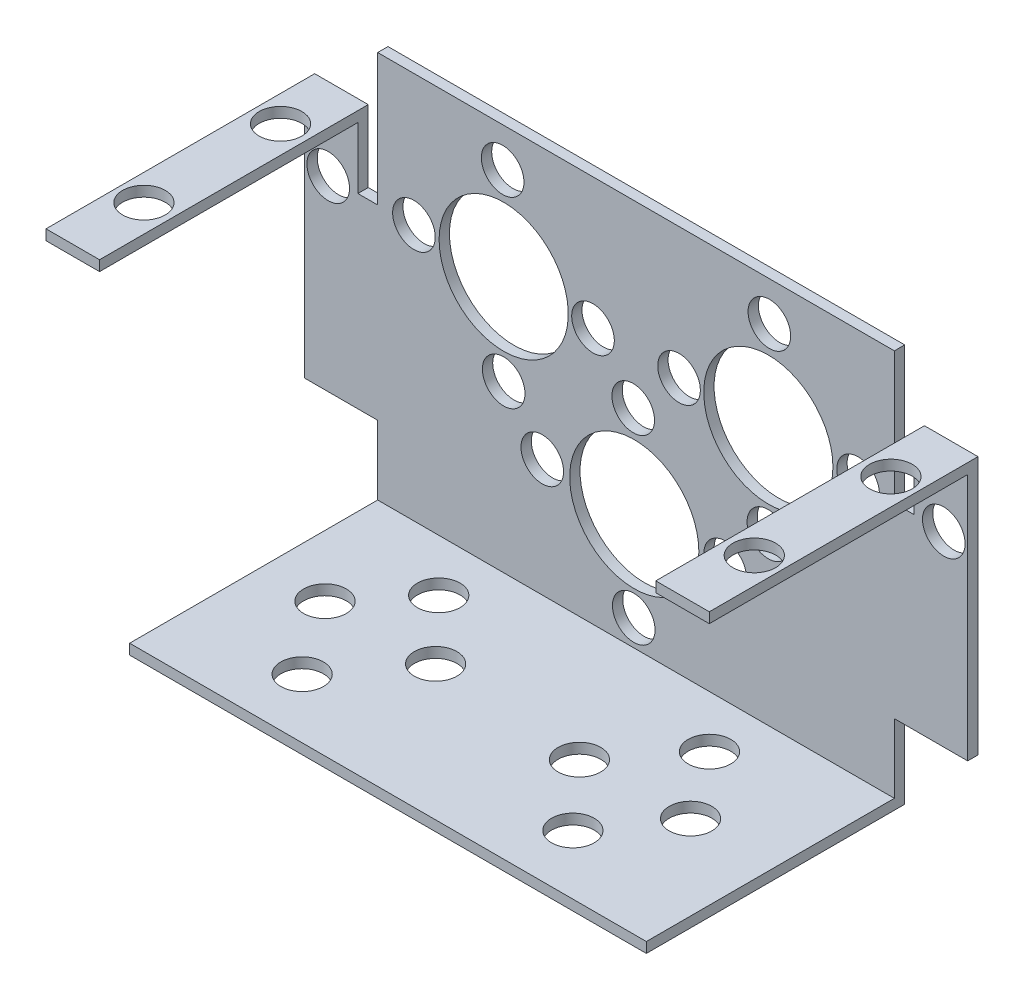
from build123d import *

# Parameters (mm, degrees)
SKETCH1_W           = 20
SKETCH1_H           = 20
BOSS_EXTRUDE1_DEPTH = 0.8
SKETCH2_W           = 20
SKETCH2_H           = 0.8
BOSS_EXTRUDE2_DEPTH = 30
SKETCH3_W           = 5.674043307
SKETCH3_H           = 20
BOSS_EXTRUDE3_DEPTH = 0.8
SKETCH4_W           = 1.528315809
SKETCH4_H           = 5.562769748
CUT_EXTRUDE1_DEPTH  = 0.8
SKETCH5_W           = 4.145727498
SKETCH5_H           = 0.8
BOSS_EXTRUDE4_DEPTH = 20
SKETCH6_R           = 5
SKETCH6_R_2         = 1.65
CUT_EXTRUDE2_DEPTH  = 20
SKETCH7_R           = 5
SKETCH7_R_2         = 1.65
CUT_EXTRUDE3_DEPTH  = 20
SKETCH8_R           = 1.65
CUT_EXTRUDE4_DEPTH  = 50


with BuildPart() as part:
    # Sketch1 → Boss-Extrude1 (new body)
    with BuildSketch(Plane(origin=(0, 0, 0), x_dir=(1, 0, 0), z_dir=(0, 1, 0))):
        with Locations((-32.618726592, -25.293632959)):
            Rectangle(SKETCH1_W, SKETCH1_H)
    extrude(amount=BOSS_EXTRUDE1_DEPTH)

    # Sketch2 → Boss-Extrude2 (add)
    with BuildSketch(Plane(origin=(0, 0.8, 0), x_dir=(1, 0, 0), z_dir=(0, 1, 0))):
        with Locations((-32.618726592, -15.693632959)):
            Rectangle(SKETCH2_W, SKETCH2_H)
    extrude(amount=BOSS_EXTRUDE2_DEPTH)

    # Sketch3 → Boss-Extrude3 (add)
    with BuildSketch(Plane.XY.offset(16.093632959)):
        with Locations((-19.781704938, 16.144118187)):
            Rectangle(SKETCH3_W, SKETCH3_H)
    extrude(amount=-BOSS_EXTRUDE3_DEPTH)

    # Sketch4 → Cut-Extrude1 (cut)
    with BuildSketch(Plane.XY.offset(16.093632959)):
        with Locations((-21.854568688, 23.362733313)):
            Rectangle(SKETCH4_W, SKETCH4_H)
    extrude(amount=-CUT_EXTRUDE1_DEPTH, mode=Mode.SUBTRACT)

    # Sketch5 → Boss-Extrude4 (add)
    with BuildSketch(Plane.XY.offset(16.093632959)):
        with Locations((-19.017547034, 25.744118187)):
            Rectangle(SKETCH5_W, SKETCH5_H)
    extrude(amount=BOSS_EXTRUDE4_DEPTH)

    # Sketch6 → Cut-Extrude2 (cut)
    with BuildSketch(Plane.XY.offset(16.093632959)):
        with Locations((-32.374776475, 20.643164179)):
            Circle(SKETCH6_R)
        with Locations((-25.427511767, 20.643164179)):
            Circle(SKETCH6_R_2)
        with Locations((-32.2953483, 27.767794826)):
            Circle(SKETCH6_R_2)
        with Locations((-32.374776475, 13.629579794)):
            Circle(SKETCH6_R_2)
        with Locations((-39.287728189, 20.643164179)):
            Circle(SKETCH6_R_2)
        with Locations((-18.792512275, 20.600265825)):
            Circle(SKETCH6_R_2)
    extrude(amount=-CUT_EXTRUDE2_DEPTH, mode=Mode.SUBTRACT)

    # Mirror1: part across plane


with BuildPart() as part_1:
    add(part.part)
    add(part.part.mirror(Plane(origin=(-42.618726592, 0.8, 15.293632959), x_dir=(0, 0, 1), z_dir=(1, 0, 0))))

    # Sketch7 → Cut-Extrude3 (cut)
    with BuildSketch(Plane.XY.offset(16.093632959)):
        with Locations((-42.753979006, 9.78162079)):
            Circle(SKETCH7_R)
        with Locations((-42.833089812, 16.852996437)):
            Circle(SKETCH7_R_2)
        with Locations((-35.716428425, 9.860731596)):
            Circle(SKETCH7_R_2)
        with Locations((-49.875113272, 9.900286998)):
            Circle(SKETCH7_R_2)
        with Locations((-42.793534409, 2.818708136)):
            Circle(SKETCH7_R_2)
    extrude(amount=-CUT_EXTRUDE3_DEPTH, mode=Mode.SUBTRACT)

    # Sketch8 → Cut-Extrude4 (cut)
    with BuildSketch(Plane(origin=(0, 26.144118187, 0), x_dir=(1, 0, 0), z_dir=(0, 1, 0))):
        with Locations(Location((-66.255888471, -19.975736512, 0), (0, 0, 270))):
            Circle(SKETCH8_R)
        with Locations(Location((-66.255888471, -30.5502563, 0), (0, 0, 270))):
            Circle(SKETCH8_R)
        with Locations(Location((-18.981564713, -19.999660765, 0), (0, 0, 270))):
            Circle(SKETCH8_R)
        with Locations(Location((-18.981564713, -30.574180553, 0), (0, 0, 270))):
            Circle(SKETCH8_R)
        with Locations(Location((-53.863125461, -20.120296701, 0), (0, 0, 270))):
            Circle(SKETCH8_R)
        with Locations(Location((-53.863125461, -30.694816488, 0), (0, 0, 270))):
            Circle(SKETCH8_R)
        with Locations(Location((-32.905479909, -20.120296701, 0), (0, 0, 270))):
            Circle(SKETCH8_R)
        with Locations(Location((-32.905479909, -30.694816488, 0), (0, 0, 270))):
            Circle(SKETCH8_R)
        with Locations(Location((-57.872940418, -24.916981338, 0), (0, 0, 270))):
            Circle(SKETCH8_R)
        with Locations(Location((-49.389566156, -24.835777395, 0), (0, 0, 270))):
            Circle(SKETCH8_R)
        with Locations(Location((-37.40026466, -25.692156073, 0), (0, 0, 270))):
            Circle(SKETCH8_R)
        with Locations(Location((-29.147888307, -25.341819341, 0), (0, 0, 270))):
            Circle(SKETCH8_R)
    extrude(amount=-CUT_EXTRUDE4_DEPTH, mode=Mode.SUBTRACT)


solid = part_1.part
